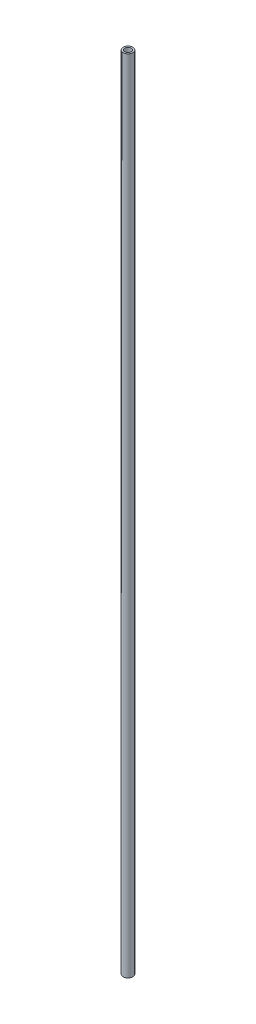
from build123d import *

# Parameters (mm, degrees)
SKIZZE1_R                       = 3
SKIZZE1_R_2                     = 2
AUFSATZ_LINEAR_AUSTRAGEN1_DEPTH = 250


with BuildPart() as part:
    # Skizze1 → Aufsatz-Linear austragen1 (new, symmetric)
    with BuildSketch(Plane(origin=(0, 0, 0), x_dir=(1, 0, 0), z_dir=(0, 1, 0))):
        with Locations(Location((0, 0, 0), (0, 0, 270))):
            Circle(SKIZZE1_R)
        with Locations(Location((0, 0, 0), (0, 0, 270))):
            Circle(SKIZZE1_R_2, mode=Mode.SUBTRACT)
    extrude(amount=AUFSATZ_LINEAR_AUSTRAGEN1_DEPTH, both=True)


solid = part.part
